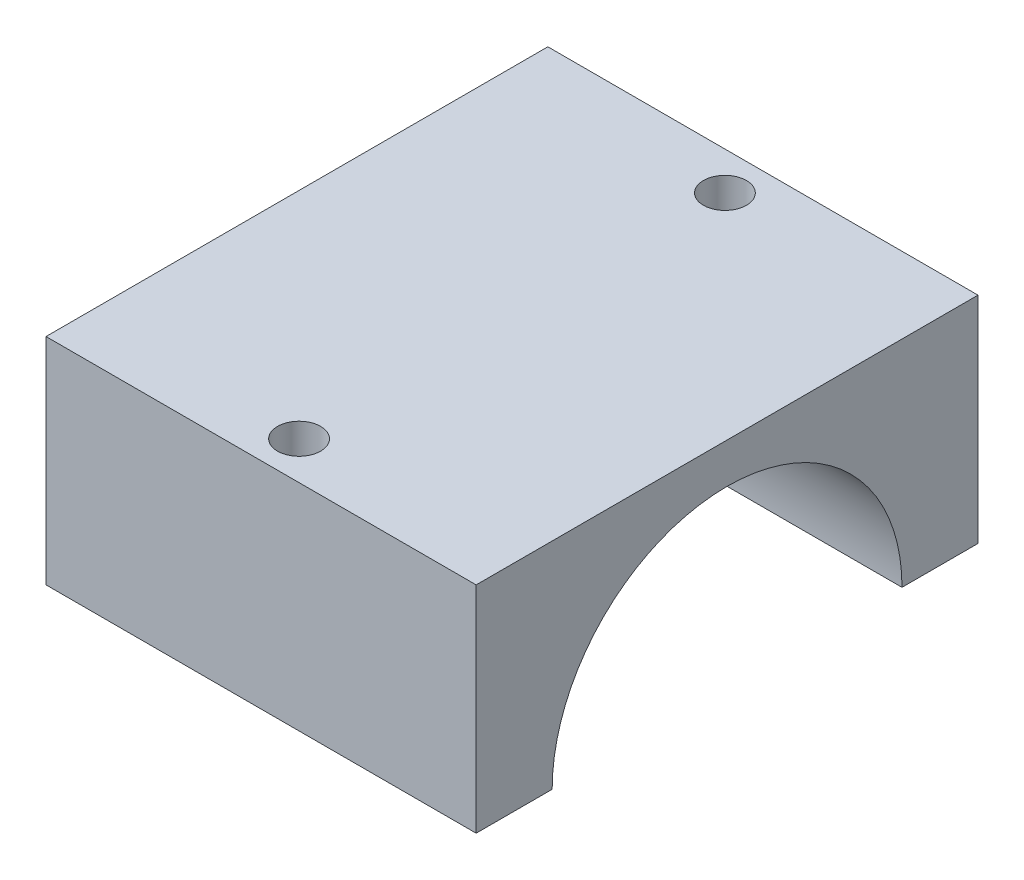
from build123d import *

# Parameters (mm, degrees)
BOSS_EXTRUDE1_DEPTH   = 30
F_3_0MM_DOWEL_HOLE1_D = 3


with BuildPart() as part:
    # Sketch1 → Boss-Extrude1 (new body)
    with BuildSketch(Plane(origin=(0, 0, 0), x_dir=(0, 0, -1), z_dir=(1, 0, 0))):
        with BuildLine():
            Line((-17.5, 0), (-17.5, 15))
            Line((-17.5, 15), (17.5, 15))
            Line((17.5, 15), (17.5, 0))
            Line((17.5, 0), (12.2, 0))
            ThreePointArc((12.2, 0), (0, 12.2), (-12.2, 0))
            Line((-12.2, 0), (-17.5, 0))
        make_face()
    extrude(amount=BOSS_EXTRUDE1_DEPTH)

    # Ø3.0mm Dowel Hole1 (through all)
    with Locations(Plane(origin=(15, 15, -14.85), x_dir=(0, 0, 1), z_dir=(0, 1, 0))):
        with Locations((0, 0), (29.7, 0)):
            Hole(F_3_0MM_DOWEL_HOLE1_D / 2)


solid = part.part
